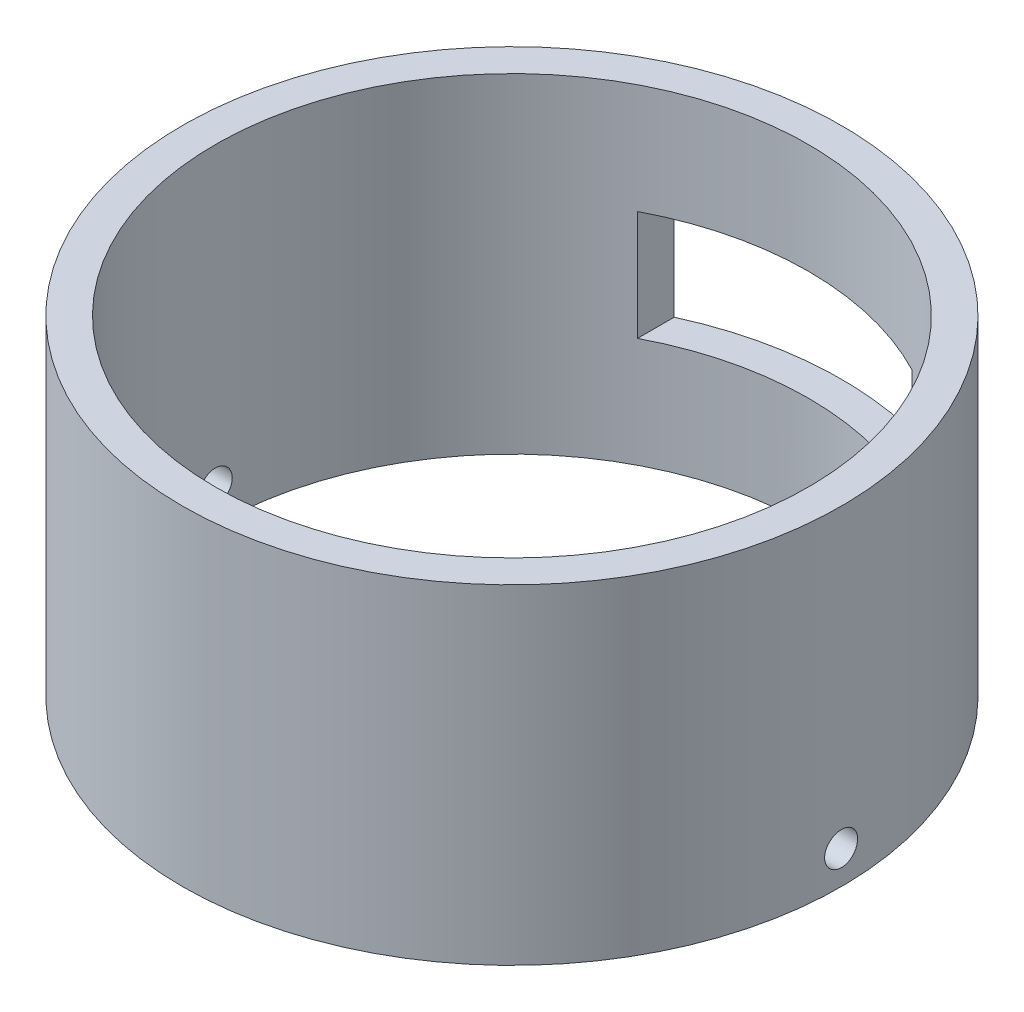
from build123d import *

# Parameters (mm, degrees)
SKETCH2_R               = 30
SKETCH2_R_2             = 27
BOSS_EXTRUDE1_DEPTH     = 30
SKETCH3_W               = 25
SKETCH3_H               = 10
CUT_EXTRUDE3_DEPTH      = 50
CUT_EXTRUDE4_DEPTH      = 52.961524227
CUT_EXTRUDE4_DEPTH_BACK = 52.961524227
SKETCH6_R               = 1.5


with BuildPart() as part:
    # Sketch2 → Boss-Extrude1 (new body)
    with BuildSketch(Plane(origin=(0, 0, 0), x_dir=(1, 0, 0), z_dir=(0, 1, 0))):
        with Locations(Location((0, 0, 0), (0, 0, 270))):
            Circle(SKETCH2_R)
        with Locations(Location((0, 0, 0), (0, 0, 270))):
            Circle(SKETCH2_R_2, mode=Mode.SUBTRACT)
    extrude(amount=BOSS_EXTRUDE1_DEPTH)

    # Sketch3 → Cut-Extrude3 (cut)
    with BuildSketch(Plane.XY):
        with Locations((0, 15)):
            Rectangle(SKETCH3_W, SKETCH3_H)
    extrude(amount=-CUT_EXTRUDE3_DEPTH, mode=Mode.SUBTRACT)

    # Sketch6 → Cut-Extrude4 (cut, two sides: drawn at the far end of the back side and taken through both)
    with BuildSketch(Plane(origin=(0, 0, 0), x_dir=(0, 0, -1), z_dir=(1, 0, 0)).offset(-CUT_EXTRUDE4_DEPTH_BACK)):
        with Locations((0, 3)):
            Circle(SKETCH6_R)
    extrude(amount=CUT_EXTRUDE4_DEPTH + CUT_EXTRUDE4_DEPTH_BACK, mode=Mode.SUBTRACT)


solid = part.part
